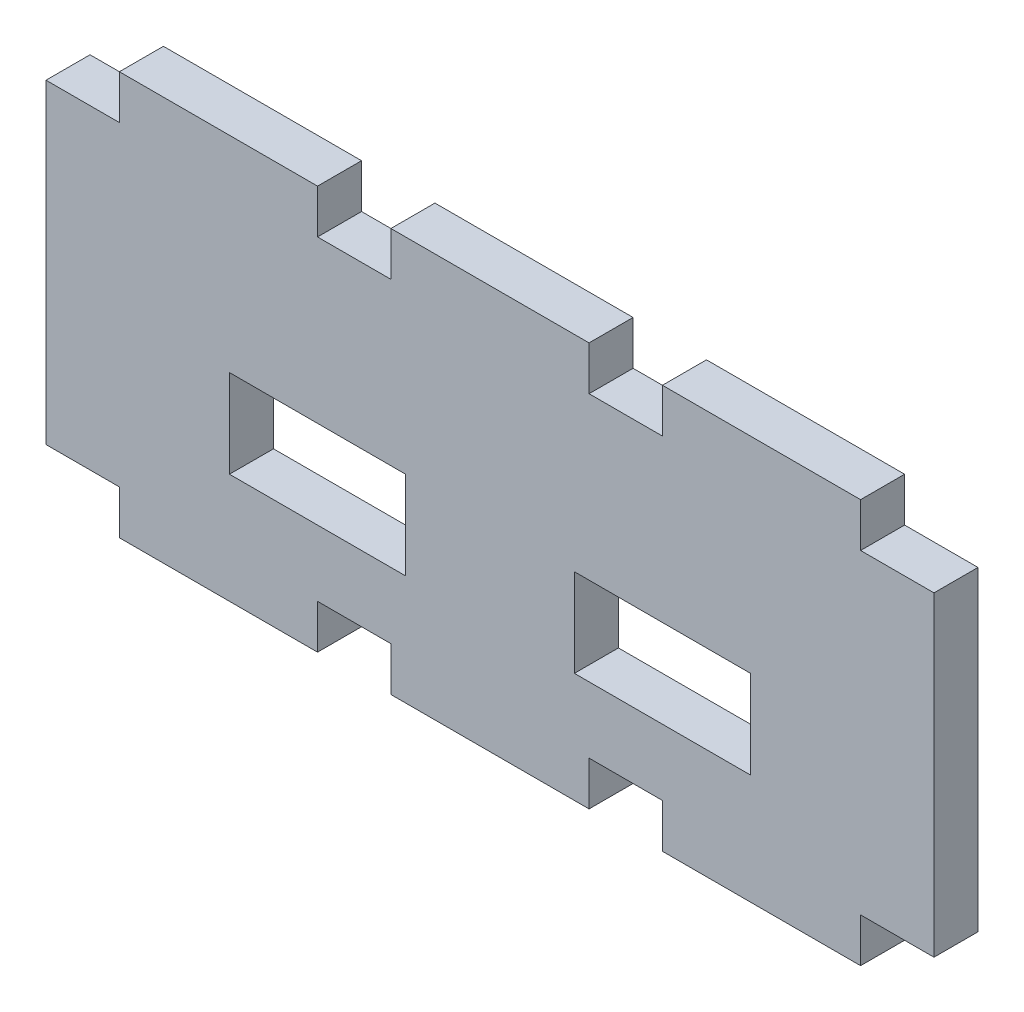
from build123d import *

# Parameters (mm, degrees)
ESQUISSE1_W             = 121
ESQUISSE1_H             = 55
BOSS_EXTRU_1_DEPTH      = 6
ESQUISSE2_W             = 10
ESQUISSE2_H             = 6
ENL_V_MAT_ENCOCHE_DEPTH = 134.048863204
ESQUISSE3_W             = 24
ESQUISSE3_H             = 12
ENL_V_MAT_EXTRU_2_DEPTH = 6


with BuildPart() as part:
    # Esquisse1 → Boss.-Extru.1 (new body)
    with BuildSketch(Plane.XY):
        with Locations((-60.5, 27.5)):
            Rectangle(ESQUISSE1_W, ESQUISSE1_H)
    extrude(amount=BOSS_EXTRU_1_DEPTH)

    # Esquisse2 → Enlèv. mat encoche (cut, through all)
    with BuildSketch(Plane.XY.offset(6)):
        with Locations((-116, 52)):
            Rectangle(ESQUISSE2_W, ESQUISSE2_H)
        with Locations((-79, 52)):
            Rectangle(ESQUISSE2_W, ESQUISSE2_H)
        with Locations((-42, 52)):
            Rectangle(ESQUISSE2_W, ESQUISSE2_H)
        with Locations((-5, 52)):
            Rectangle(ESQUISSE2_W, ESQUISSE2_H)
        with Locations((-116, 3)):
            Rectangle(ESQUISSE2_W, ESQUISSE2_H)
        with Locations((-79, 3)):
            Rectangle(ESQUISSE2_W, ESQUISSE2_H)
        with Locations((-42, 3)):
            Rectangle(ESQUISSE2_W, ESQUISSE2_H)
        with Locations((-5, 3)):
            Rectangle(ESQUISSE2_W, ESQUISSE2_H)
    extrude(amount=-ENL_V_MAT_ENCOCHE_DEPTH, mode=Mode.SUBTRACT)

    # Esquisse3 → Enlèv. mat.-Extru.2 (cut)
    with BuildSketch(Plane.XY.offset(6)):
        with Locations((-84, 21)):
            Rectangle(ESQUISSE3_W, ESQUISSE3_H)
        with Locations((-37, 21)):
            Rectangle(ESQUISSE3_W, ESQUISSE3_H)
    extrude(amount=-ENL_V_MAT_EXTRU_2_DEPTH, mode=Mode.SUBTRACT)


solid = part.part
